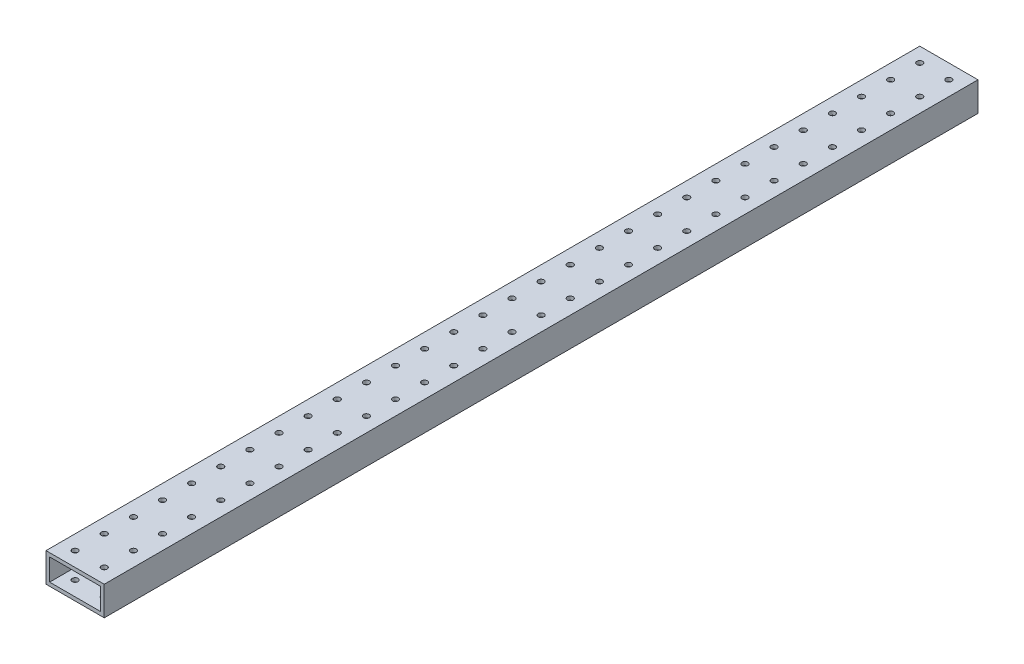
from build123d import *

# Parameters (mm, degrees)
SKETCH1_W           = 50.8
SKETCH1_H           = 25.4
SKETCH1_W_2         = 44.45
SKETCH1_H_2         = 19.05
BOSS_EXTRUDE1_DEPTH = 762
SKETCH2_R           = 2.54
CUT_EXTRUDE1_DEPTH  = 25.4


with BuildPart() as part:
    # Sketch1 → Boss-Extrude1 (new body)
    with BuildSketch(Plane.XY):
        Rectangle(SKETCH1_W, SKETCH1_H)
        Rectangle(SKETCH1_W_2, SKETCH1_H_2, mode=Mode.SUBTRACT)
    extrude(amount=BOSS_EXTRUDE1_DEPTH)

    # Sketch2 → Cut-Extrude1 (cut)
    with BuildSketch(Plane(origin=(0, 12.7, 0), x_dir=(1, 0, 0), z_dir=(0, 1, 0))):
        with Locations(Location((-12.7, -12.7, 0), (0, 0, 270))):
            Circle(SKETCH2_R)
        with Locations(Location((12.7, -12.7, 0), (0, 0, 270))):
            Circle(SKETCH2_R)
        with Locations(Location((-12.7, -38.1, 0), (0, 0, 270))):
            Circle(SKETCH2_R)
        with Locations(Location((12.7, -38.1, 0), (0, 0, 270))):
            Circle(SKETCH2_R)
        with Locations(Location((-12.7, -63.5, 0), (0, 0, 270))):
            Circle(SKETCH2_R)
        with Locations(Location((12.7, -63.5, 0), (0, 0, 270))):
            Circle(SKETCH2_R)
        with Locations(Location((-12.7, -88.9, 0), (0, 0, 270))):
            Circle(SKETCH2_R)
        with Locations(Location((12.7, -88.9, 0), (0, 0, 270))):
            Circle(SKETCH2_R)
        with Locations(Location((-12.7, -114.3, 0), (0, 0, 270))):
            Circle(SKETCH2_R)
        with Locations(Location((12.7, -114.3, 0), (0, 0, 270))):
            Circle(SKETCH2_R)
        with Locations(Location((-12.7, -139.7, 0), (0, 0, 270))):
            Circle(SKETCH2_R)
        with Locations(Location((12.7, -139.7, 0), (0, 0, 270))):
            Circle(SKETCH2_R)
        with Locations(Location((-12.7, -165.1, 0), (0, 0, 270))):
            Circle(SKETCH2_R)
        with Locations(Location((12.7, -165.1, 0), (0, 0, 270))):
            Circle(SKETCH2_R)
        with Locations(Location((-12.7, -190.5, 0), (0, 0, 270))):
            Circle(SKETCH2_R)
        with Locations(Location((12.7, -190.5, 0), (0, 0, 270))):
            Circle(SKETCH2_R)
        with Locations(Location((-12.7, -215.9, 0), (0, 0, 270))):
            Circle(SKETCH2_R)
        with Locations(Location((12.7, -215.9, 0), (0, 0, 270))):
            Circle(SKETCH2_R)
        with Locations(Location((-12.7, -241.3, 0), (0, 0, 270))):
            Circle(SKETCH2_R)
        with Locations(Location((12.7, -241.3, 0), (0, 0, 270))):
            Circle(SKETCH2_R)
        with Locations(Location((-12.7, -266.7, 0), (0, 0, 270))):
            Circle(SKETCH2_R)
        with Locations(Location((12.7, -266.7, 0), (0, 0, 270))):
            Circle(SKETCH2_R)
        with Locations(Location((-12.7, -292.1, 0), (0, 0, 270))):
            Circle(SKETCH2_R)
        with Locations(Location((12.7, -292.1, 0), (0, 0, 270))):
            Circle(SKETCH2_R)
        with Locations(Location((-12.7, -317.5, 0), (0, 0, 270))):
            Circle(SKETCH2_R)
        with Locations(Location((12.7, -317.5, 0), (0, 0, 270))):
            Circle(SKETCH2_R)
        with Locations(Location((-12.7, -342.9, 0), (0, 0, 270))):
            Circle(SKETCH2_R)
        with Locations(Location((12.7, -342.9, 0), (0, 0, 270))):
            Circle(SKETCH2_R)
        with Locations(Location((-12.7, -368.3, 0), (0, 0, 270))):
            Circle(SKETCH2_R)
        with Locations(Location((12.7, -368.3, 0), (0, 0, 270))):
            Circle(SKETCH2_R)
        with Locations(Location((12.7, -393.7, 0), (0, 0, 270))):
            Circle(SKETCH2_R)
        with Locations(Location((-12.7, -393.7, 0), (0, 0, 270))):
            Circle(SKETCH2_R)
        with Locations(Location((12.7, -419.1, 0), (0, 0, 270))):
            Circle(SKETCH2_R)
        with Locations(Location((-12.7, -419.1, 0), (0, 0, 270))):
            Circle(SKETCH2_R)
        with Locations(Location((12.7, -444.5, 0), (0, 0, 270))):
            Circle(SKETCH2_R)
        with Locations(Location((-12.7, -444.5, 0), (0, 0, 270))):
            Circle(SKETCH2_R)
        with Locations(Location((12.7, -469.9, 0), (0, 0, 270))):
            Circle(SKETCH2_R)
        with Locations(Location((-12.7, -469.9, 0), (0, 0, 270))):
            Circle(SKETCH2_R)
        with Locations(Location((12.7, -495.3, 0), (0, 0, 270))):
            Circle(SKETCH2_R)
        with Locations(Location((-12.7, -495.3, 0), (0, 0, 270))):
            Circle(SKETCH2_R)
        with Locations(Location((12.7, -520.7, 0), (0, 0, 270))):
            Circle(SKETCH2_R)
        with Locations(Location((-12.7, -520.7, 0), (0, 0, 270))):
            Circle(SKETCH2_R)
        with Locations(Location((12.7, -546.1, 0), (0, 0, 270))):
            Circle(SKETCH2_R)
        with Locations(Location((-12.7, -546.1, 0), (0, 0, 270))):
            Circle(SKETCH2_R)
        with Locations(Location((12.7, -571.5, 0), (0, 0, 270))):
            Circle(SKETCH2_R)
        with Locations(Location((-12.7, -571.5, 0), (0, 0, 270))):
            Circle(SKETCH2_R)
        with Locations(Location((12.7, -596.9, 0), (0, 0, 270))):
            Circle(SKETCH2_R)
        with Locations(Location((-12.7, -596.9, 0), (0, 0, 270))):
            Circle(SKETCH2_R)
        with Locations(Location((12.7, -622.3, 0), (0, 0, 270))):
            Circle(SKETCH2_R)
        with Locations(Location((-12.7, -622.3, 0), (0, 0, 270))):
            Circle(SKETCH2_R)
        with Locations(Location((12.7, -647.7, 0), (0, 0, 270))):
            Circle(SKETCH2_R)
        with Locations(Location((-12.7, -647.7, 0), (0, 0, 270))):
            Circle(SKETCH2_R)
        with Locations(Location((12.7, -673.1, 0), (0, 0, 270))):
            Circle(SKETCH2_R)
        with Locations(Location((-12.7, -673.1, 0), (0, 0, 270))):
            Circle(SKETCH2_R)
        with Locations(Location((12.7, -698.5, 0), (0, 0, 270))):
            Circle(SKETCH2_R)
        with Locations(Location((-12.7, -698.5, 0), (0, 0, 270))):
            Circle(SKETCH2_R)
        with Locations(Location((12.7, -723.9, 0), (0, 0, 270))):
            Circle(SKETCH2_R)
        with Locations(Location((-12.7, -723.9, 0), (0, 0, 270))):
            Circle(SKETCH2_R)
        with Locations(Location((12.7, -749.3, 0), (0, 0, 270))):
            Circle(SKETCH2_R)
        with Locations(Location((-12.7, -749.3, 0), (0, 0, 270))):
            Circle(SKETCH2_R)
    extrude(amount=-CUT_EXTRUDE1_DEPTH, mode=Mode.SUBTRACT)


solid = part.part
